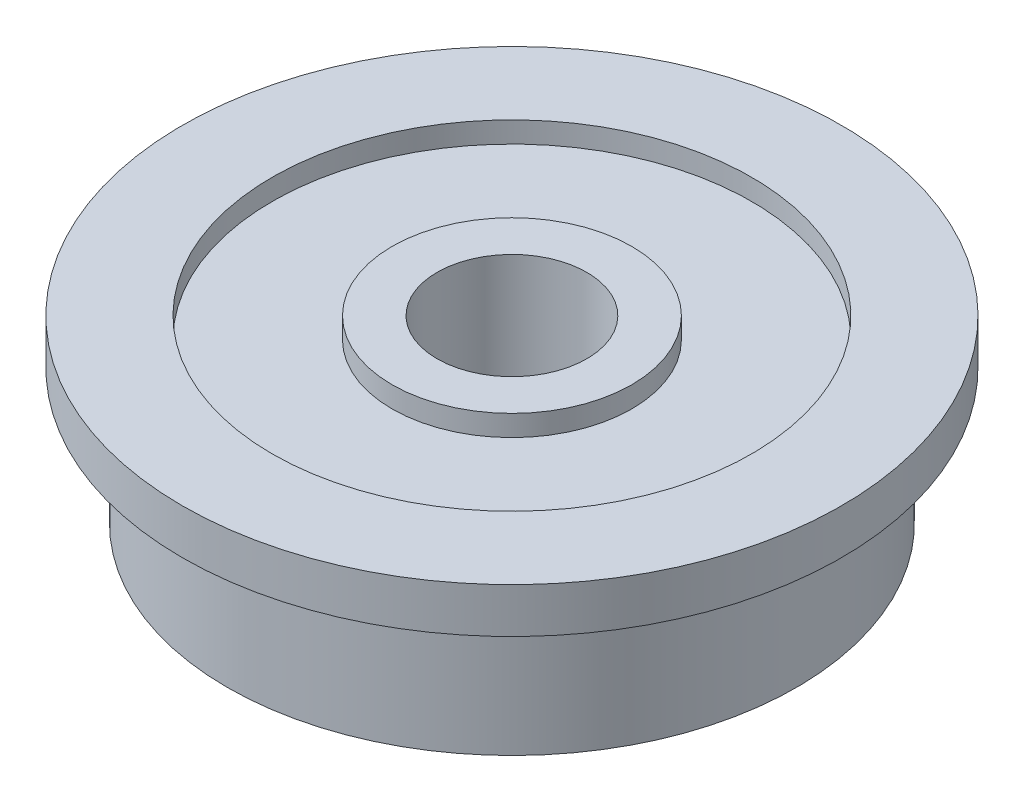
from build123d import *

# Parameters (mm, degrees)
SKETCH_2_R      = 11
SKETCH_2_R_2    = 9.5
EXTRUDE_1_DEPTH = 1.5


with BuildPart() as part:
    # 草图1 → 旋转1 (revolve)
    with BuildSketch(Plane.XY, mode=Mode.PRIVATE) as revolve_1_sk:
        Polygon((2.5, 6), (2.5, 0), (4, 0), (4, 0.7), (8, 0.7), (8, 0), (9.5, 0), (9.5, 6), (8, 6), (8, 5.3), (4, 5.3), (4, 6), align=None)
    revolve(revolve_1_sk.sketch.rotate(Axis((0, 4.611296038, 0), (0, -1, 0)), 90), axis=Axis((0, 4.611296038, 0), (0, -1, 0)))

    # 草图2 → 凸台-拉伸1 (add)
    with BuildSketch(Plane(origin=(0, 6, 0), x_dir=(1, 0, 0), z_dir=(0, 1, 0))):
        with Locations(Location((0, 0, 0), (0, 0, 270))):
            Circle(SKETCH_2_R)
        with Locations(Location((0, 0, 0), (0, 0, 270))):
            Circle(SKETCH_2_R_2, mode=Mode.SUBTRACT)
    extrude(amount=-EXTRUDE_1_DEPTH)


solid = part.part
